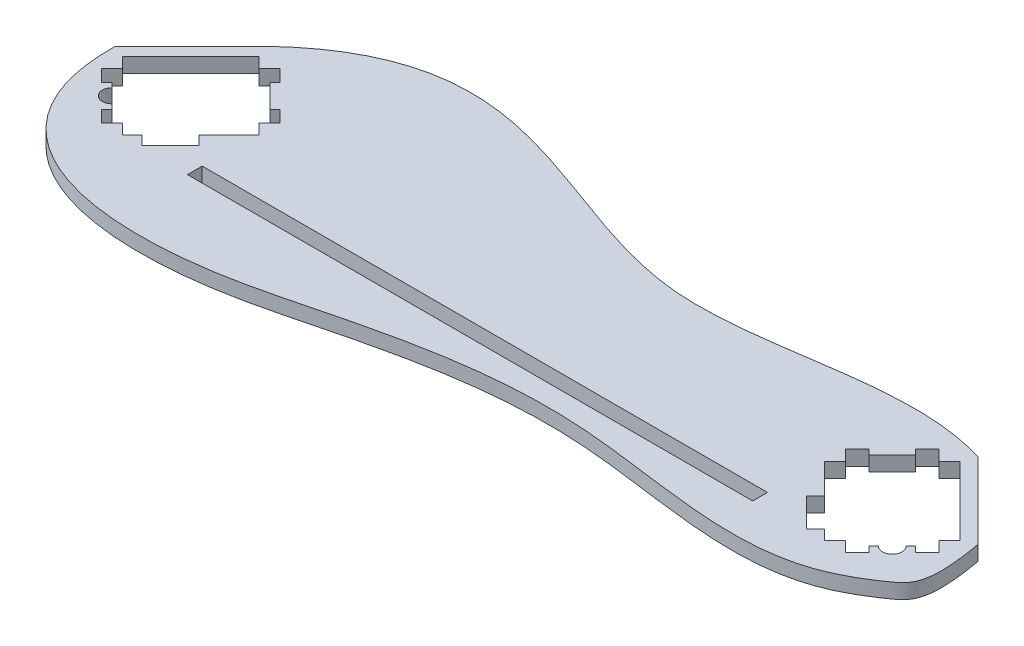
from build123d import *

# Parameters (mm, degrees)
BOSS_EXTRUDE1_DEPTH = 3


with BuildPart() as part:
    # Sketch1 → Boss-Extrude1 (new body)
    with BuildSketch(Plane(origin=(0, 0, 0), x_dir=(1, 0, 0), z_dir=(0, 1, 0))):
        with BuildLine():
            add(Edge.make_bspline(
                [(-72.026610681, 29.18437443), (-42.481041168, 56.992221829), (2.161924369, 11.767108555), (52.669252787, 35.367110856), (72.654610681, 29.18437443)],
                knots=[0, 0, 0, 0, 0.586493816, 1, 1, 1, 1], degree=3))
            Line((-72.026610681, 29.18437443), (-87.442245618, 13.768739494))
            add(Edge.make_bspline(
                [(-87.442245618, 13.768739494), (-88.006365767, -16.607219843), (-54.281168224, -20.989242866), (-5.532297252, -8.069789459), (24.131303024, -2.337302931), (67.274298351, -13.125612898), (85.830350167, -2.055035894), (90.270330864, 1.711295424), (88.070245618, 13.768739494)],
                knots=[0, 0, 0, 0, 0.345715276, 0.403088727, 0.66858495, 0.888291272, 0.948309032, 1, 1, 1, 1], degree=3))
            Line((88.070245618, 13.768739494), (72.654610681, 29.18437443))
        make_face()
        with BuildLine():
            Line((-59.307320344, 14.909320344), (-57.186, 12.788))
            Line((-57.186, 12.788), (-63.332172142, 6.641827858))
            Line((-63.332172142, 6.641827858), (-61.508543753, 4.818199469))
            Line((-61.508543753, 4.818199469), (-67.286313262, -0.95957004))
            Line((-67.286313262, -0.95957004), (-69.109941651, 0.864058349))
            Line((-69.109941651, 0.864058349), (-71.118832016, -1.144832016))
            Line((-71.118832016, -1.144832016), (-73.24015236, 0.976488327))
            Line((-73.24015236, 0.976488327), (-75.362886917, -1.14624623))
            Line((-75.362886917, -1.14624623), (-77.749372304, 1.240239156))
            Line((-77.749372304, 1.240239156), (-76.651942579, 2.337668881))
            Line((-76.651942579, 2.337668881), (-77.624214403, 3.309940705))
            ThreePointArc((-77.624214403, 3.309940705), (-80.452641528, 3.309940705), (-80.452641528, 6.13836783))
            Line((-80.452641528, 6.13836783), (-81.424913352, 7.110639654))
            Line((-81.424913352, 7.110639654), (-82.522343077, 6.013209929))
            Line((-82.522343077, 6.013209929), (-84.908828463, 8.399695316))
            Line((-84.908828463, 8.399695316), (-82.786093906, 10.522429873))
            Line((-82.786093906, 10.522429873), (-84.90741425, 12.643750217))
            Line((-84.90741425, 12.643750217), (-70.974582233, 26.576582233))
            Line((-70.974582233, 26.576582233), (-68.85326189, 24.45526189))
            Line((-68.85326189, 24.45526189), (-66.730527332, 26.577996447))
            Line((-66.730527332, 26.577996447), (-64.344041946, 24.19151106))
            Line((-64.344041946, 24.19151106), (-65.370760992, 23.164792014))
            Line((-65.370760992, 23.164792014), (-60.597790219, 18.391821241))
            Line((-60.597790219, 18.391821241), (-59.571071173, 19.418540287))
            Line((-59.571071173, 19.418540287), (-57.184585786, 17.032054901))
            Line((-57.184585786, 17.032054901), (-59.307320344, 14.909320344))
        make_face(mode=Mode.SUBTRACT)
        Polygon((-57.5, -1.5), (-57.5, 1.5), (57.409393497, 1.5), (57.5, 1.5), (57.5, -1.5), align=None, mode=Mode.SUBTRACT)
        with BuildLine():
            Line((71.746832016, -1.144832016), (69.737941651, 0.864058349))
            Line((69.737941651, 0.864058349), (67.914313262, -0.95957004))
            Line((67.914313262, -0.95957004), (62.136543753, 4.818199469))
            Line((62.136543753, 4.818199469), (63.960172142, 6.641827858))
            Line((63.960172142, 6.641827858), (57.814, 12.788))
            Line((57.814, 12.788), (59.935320344, 14.909320344))
            Line((59.935320344, 14.909320344), (57.812585786, 17.032054901))
            Line((57.812585786, 17.032054901), (60.199071173, 19.418540287))
            Line((60.199071173, 19.418540287), (61.225790219, 18.391821241))
            Line((61.225790219, 18.391821241), (65.998760992, 23.164792014))
            Line((65.998760992, 23.164792014), (64.972041946, 24.19151106))
            Line((64.972041946, 24.19151106), (67.358527332, 26.577996447))
            Line((67.358527332, 26.577996447), (69.48126189, 24.45526189))
            Line((69.48126189, 24.45526189), (71.602582233, 26.576582233))
            Line((71.602582233, 26.576582233), (85.53541425, 12.643750217))
            Line((85.53541425, 12.643750217), (83.414093906, 10.522429873))
            Line((83.414093906, 10.522429873), (85.536828463, 8.399695316))
            Line((85.536828463, 8.399695316), (83.150343077, 6.013209929))
            Line((83.150343077, 6.013209929), (82.052913352, 7.110639654))
            Line((82.052913352, 7.110639654), (81.080641528, 6.13836783))
            ThreePointArc((81.080641528, 6.13836783), (81.514187031, 5.489521132), (81.666427966, 4.724154267))
            ThreePointArc((81.666427966, 4.724154267), (80.431794831, 2.876395202), (78.252214403, 3.309940705))
            Line((78.252214403, 3.309940705), (77.279942579, 2.337668881))
            Line((77.279942579, 2.337668881), (78.377372304, 1.240239156))
            Line((78.377372304, 1.240239156), (75.990886917, -1.14624623))
            Line((75.990886917, -1.14624623), (73.86815236, 0.976488327))
            Line((73.86815236, 0.976488327), (71.746832016, -1.144832016))
        make_face(mode=Mode.SUBTRACT)
    extrude(amount=BOSS_EXTRUDE1_DEPTH)


solid = part.part
